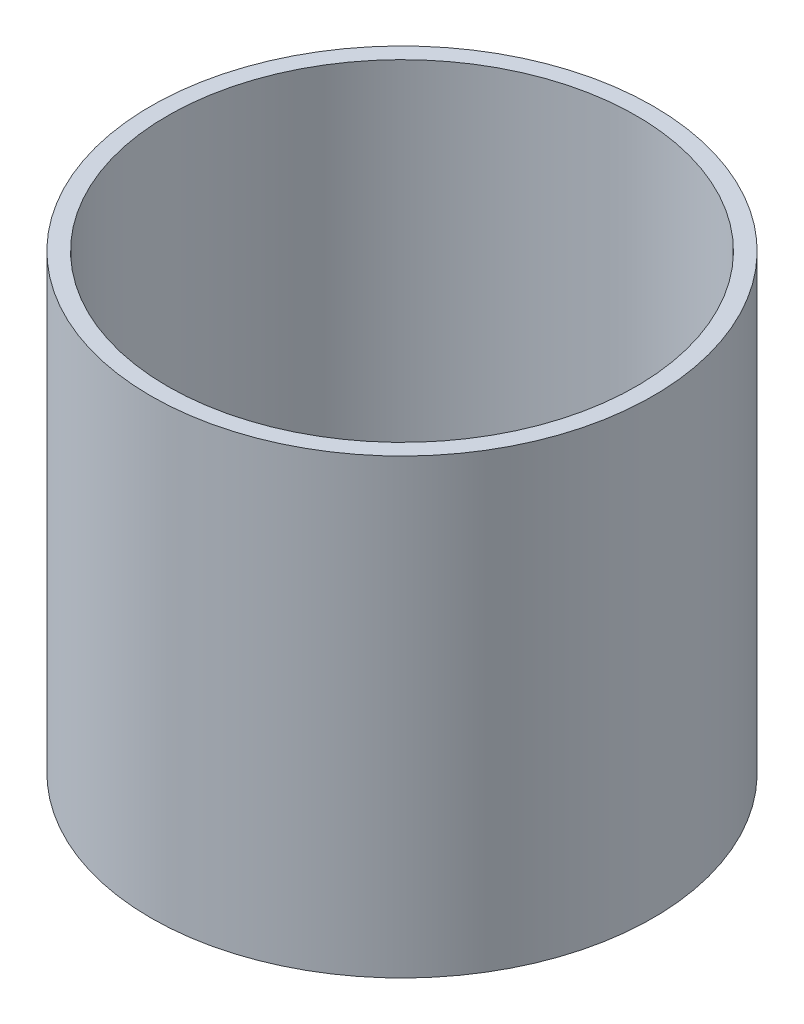
from build123d import *

# Parameters (mm, degrees)
SKETCH1_R           = 22.5
SKETCH1_R_2         = 21
BOSS_EXTRUDE1_DEPTH = 35.5
BOSS_EXTRUDE2_START = 5
SKETCH2_R           = 22.5
BOSS_EXTRUDE2_DEPTH = 5


with BuildPart() as part:
    # Sketch1 → Boss-Extrude1 (new body)
    with BuildSketch(Plane(origin=(0, 0, 0), x_dir=(1, 0, 0), z_dir=(0, 1, 0))):
        with Locations(Location((0, 0, 0), (0, 0, 270))):
            Circle(SKETCH1_R)
        with Locations(Location((0, 0, 0), (0, 0, 270))):
            Circle(SKETCH1_R_2, mode=Mode.SUBTRACT)
    extrude(amount=BOSS_EXTRUDE1_DEPTH)

    # Sketch2 → Boss-Extrude2 (add)
    with BuildSketch(Plane.XZ.offset(BOSS_EXTRUDE2_START)):
        with Locations(Location((0, 0, 0), (0, 0, 270))):
            Circle(SKETCH2_R)
    extrude(amount=-BOSS_EXTRUDE2_DEPTH)


solid = part.part
